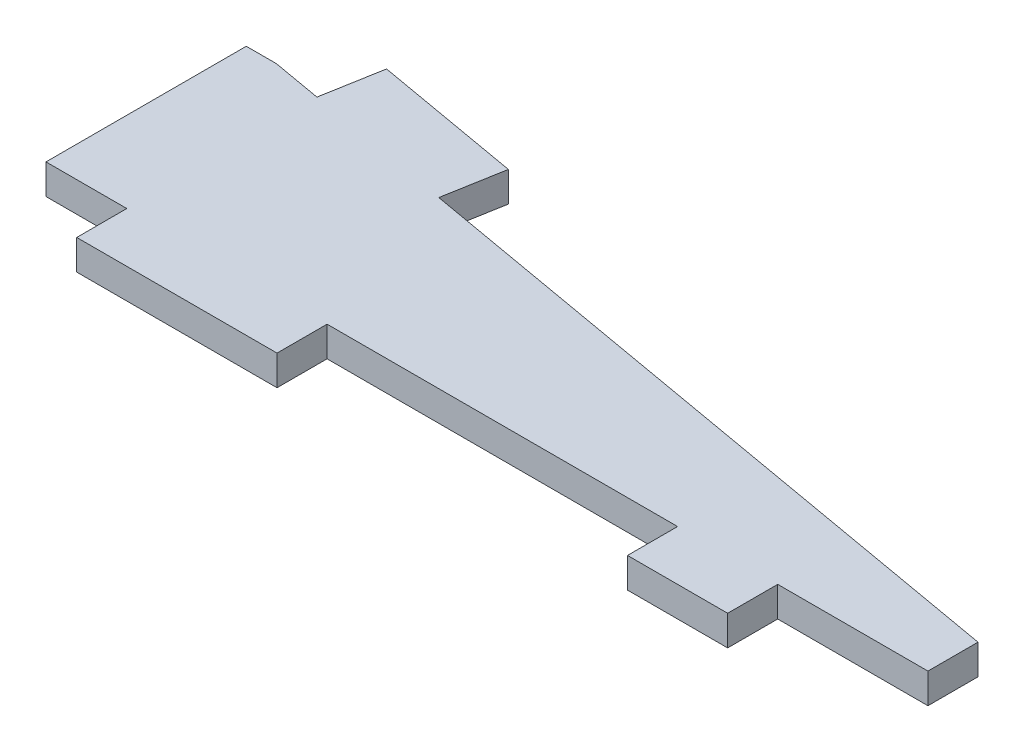
from build123d import *

# Parameters (mm, degrees)
BOSS_EXTRUDE1_DEPTH = 3
SKETCH2_W           = 10
SKETCH2_H           = 5
BOSS_EXTRUDE2_DEPTH = 3
BOSS_EXTRUDE3_DEPTH = 3


with BuildPart() as part:
    # Sketch1 → Boss-Extrude1 (new body)
    with BuildSketch(Plane(origin=(0, 0, 0), x_dir=(1, 0, 0), z_dir=(0, 1, 0))):
        Polygon((20, 0), (20, 5), (80, 5), (80, 10), (-5.069227294, 25), (-8.069227294, 25), (-8.069227294, 5), (0, 5), (0, 0), align=None)
    extrude(amount=BOSS_EXTRUDE1_DEPTH)

    # Sketch2 → Boss-Extrude2 (add)
    with BuildSketch(Plane(origin=(0, 3, 0), x_dir=(1, 0, 0), z_dir=(0, 1, 0))):
        with Locations((60, 2.5)):
            Rectangle(SKETCH2_W, SKETCH2_H)
    extrude(amount=-BOSS_EXTRUDE2_DEPTH)

    # Sketch3 → Boss-Extrude3 (add)
    with BuildSketch(Plane(origin=(0, 3, 0), x_dir=(1, 0, 0), z_dir=(0, 1, 0))):
        Polygon((-0.145188529, 24.131759112), (14.626927766, 21.527036447), (15.668816832, 27.435882965), (0.896700537, 30.04060563), align=None)
    extrude(amount=-BOSS_EXTRUDE3_DEPTH)


solid = part.part
